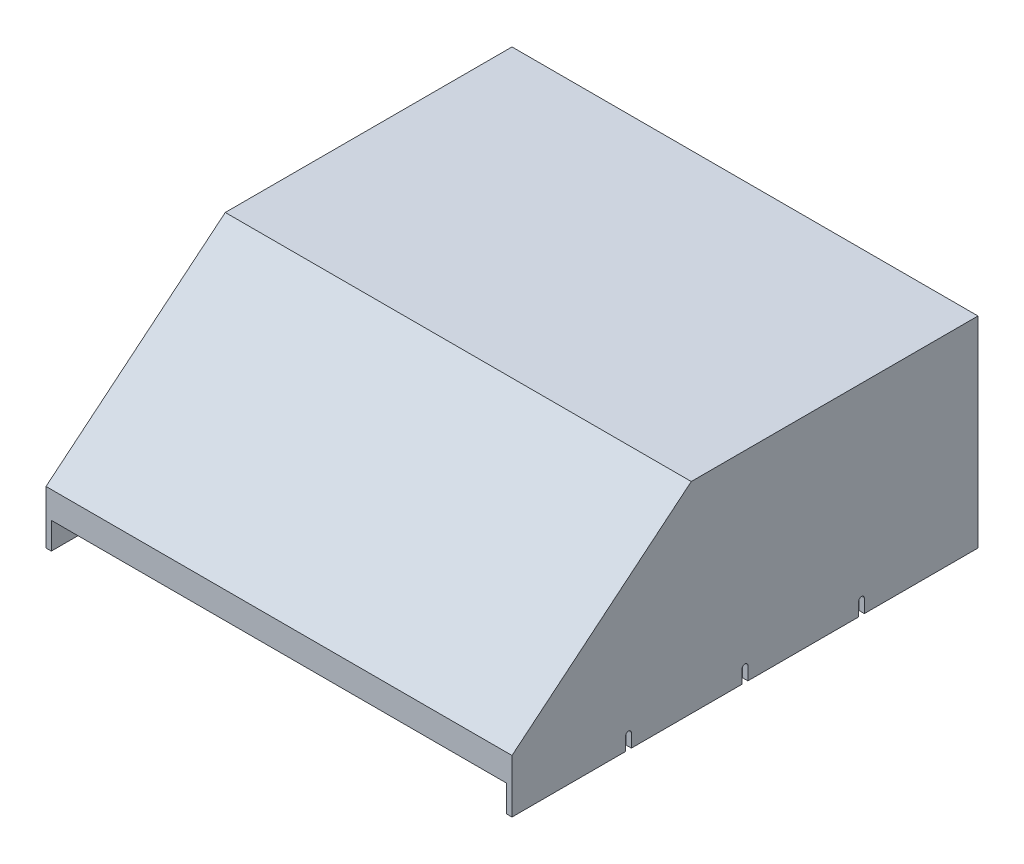
from build123d import *

# Parameters (mm, degrees)
ESTRUSIONE_ESTRUSIONE1_DEPTH = 524
SVUOTA1_T                    = -6
SCHIZZO2_W                   = 512
SCHIZZO2_H                   = 6
TAGLIO_ESTRUSIONE1_DEPTH     = 30
SCHIZZO3_W                   = 512
SCHIZZO3_H                   = 6
TAGLIO_ESTRUSIONE2_DEPTH     = 80
TAGLIO_ESTRUSIONE3_DEPTH     = 775.74382863


with BuildPart() as part:
    # Schizzo1 → Estrusione-Estrusione1 (new body)
    with BuildSketch(Plane(origin=(0, 0, 0), x_dir=(0, 0, -1), z_dir=(1, 0, 0))):
        Polygon((524, 0), (524, 226), (201.576132106, 226), (0, 60), (0, 0), align=None)
    extrude(amount=ESTRUSIONE_ESTRUSIONE1_DEPTH)

    # Svuota1
    svuota1_openings = [part.faces().sort_by_distance(p)[0] for p in [
        (262, 0, -262),
    ]]
    offset(amount=SVUOTA1_T, openings=svuota1_openings, kind=Kind.INTERSECTION)

    # Schizzo2 → Taglio-Estrusione1 (cut)
    with BuildSketch(Plane.XZ):
        with Locations((262, -3)):
            Rectangle(SCHIZZO2_W, SCHIZZO2_H)
    extrude(amount=-TAGLIO_ESTRUSIONE1_DEPTH, mode=Mode.SUBTRACT)

    # Schizzo3 → Taglio-Estrusione2 (cut)
    with BuildSketch(Plane.XZ):
        with Locations((262, -521)):
            Rectangle(SCHIZZO3_W, SCHIZZO3_H)
    extrude(amount=-TAGLIO_ESTRUSIONE2_DEPTH, mode=Mode.SUBTRACT)

    # Schizzo4 → Taglio-Estrusione3 (cut, through all)
    with BuildSketch(Plane.ZY):
        with BuildLine():
            Line((-396.25, 15), (-396.25, 0))
            Line((-396.25, 0), (-389.75, 0))
            Line((-389.75, 0), (-389.75, 15))
            ThreePointArc((-389.75, 15), (-393, 18.25), (-396.25, 15))
        make_face()
        with BuildLine():
            Line((-265.25, 15), (-265.25, 0))
            Line((-265.25, 0), (-258.75, 0))
            Line((-258.75, 0), (-258.75, 15))
            ThreePointArc((-258.75, 15), (-262, 18.25), (-265.25, 15))
        make_face()
        with BuildLine():
            Line((-134.25, 0), (-127.75, 0))
            Line((-127.75, 0), (-127.75, 15))
            ThreePointArc((-127.75, 15), (-131, 18.25), (-134.25, 15))
            Line((-134.25, 15), (-134.25, 0))
        make_face()
    extrude(amount=-TAGLIO_ESTRUSIONE3_DEPTH, mode=Mode.SUBTRACT)


solid = part.part
